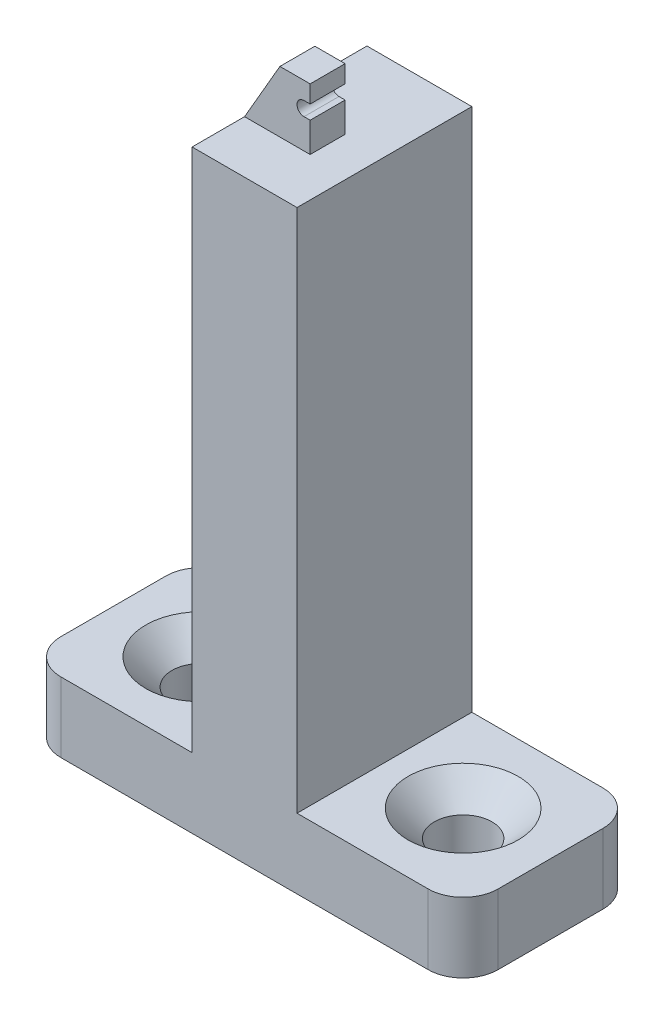
from build123d import *

# Parameters (mm, degrees)
SKETCH1_W                                       = 50
SKETCH1_H                                       = 20
BOSS_EXTRUDE1_DEPTH                             = 8
CSK_FOR_M6_FLAT_HEAD_MACHINE_SCREW1_D           = 6.6
CSK_FOR_M6_FLAT_HEAD_MACHINE_SCREW1_CSINK_D     = 12.6
CSK_FOR_M6_FLAT_HEAD_MACHINE_SCREW1_CSINK_ANGLE = 90
FILLET1_R                                       = 4
SKETCH3_W                                       = 12
SKETCH3_H                                       = 20
BOSS_EXTRUDE2_DEPTH                             = 60
BOSS_EXTRUDE3_DEPTH                             = 4


with BuildPart() as part:
    # Sketch1 → Boss-Extrude1 (new body)
    with BuildSketch(Plane(origin=(0, 0, 0), x_dir=(1, 0, 0), z_dir=(0, 1, 0))):
        Rectangle(SKETCH1_W, SKETCH1_H)
    extrude(amount=BOSS_EXTRUDE1_DEPTH)

    # CSK for M6 Flat Head Machine Screw1 (through all)
    with Locations(Plane(origin=(-15, 8, 0), x_dir=(0, 0, 1), z_dir=(0, 1, 0))):
        with Locations((0, 0), (0, 30)):
            CounterSinkHole(CSK_FOR_M6_FLAT_HEAD_MACHINE_SCREW1_D / 2, CSK_FOR_M6_FLAT_HEAD_MACHINE_SCREW1_CSINK_D / 2, counter_sink_angle=CSK_FOR_M6_FLAT_HEAD_MACHINE_SCREW1_CSINK_ANGLE)

    # Fillet1
    fillet1_edges = [part.edges().sort_by_distance(p)[0] for p in [
        (-25, 4, -10),
        (25, 4, -10),
        (25, 4, 10),
        (-25, 4, 10),
    ]]
    fillet(fillet1_edges, radius=FILLET1_R)

    # Sketch3 → Boss-Extrude2 (add)
    with BuildSketch(Plane(origin=(0, 8, 0), x_dir=(1, 0, 0), z_dir=(0, 1, 0))):
        Rectangle(SKETCH3_W, SKETCH3_H)
    extrude(amount=BOSS_EXTRUDE2_DEPTH)

    # Sketch4 → Boss-Extrude3 (add)
    with BuildSketch(Plane.XY):
        with BuildLine():
            Line((-6, 68), (-1.958548116, 75))
            Line((-1.958548116, 75), (1.5, 75))
            Line((1.5, 75), (1.5, 73))
            Line((1.5, 73), (0.8, 73))
            ThreePointArc((0.8, 73), (0, 72.2), (0.8, 71.4))
            Line((0.8, 71.4), (1.5, 71.4))
            Line((1.5, 71.4), (1.5, 68))
            Line((1.5, 68), (-6, 68))
        make_face()
    extrude(amount=BOSS_EXTRUDE3_DEPTH)


solid = part.part
